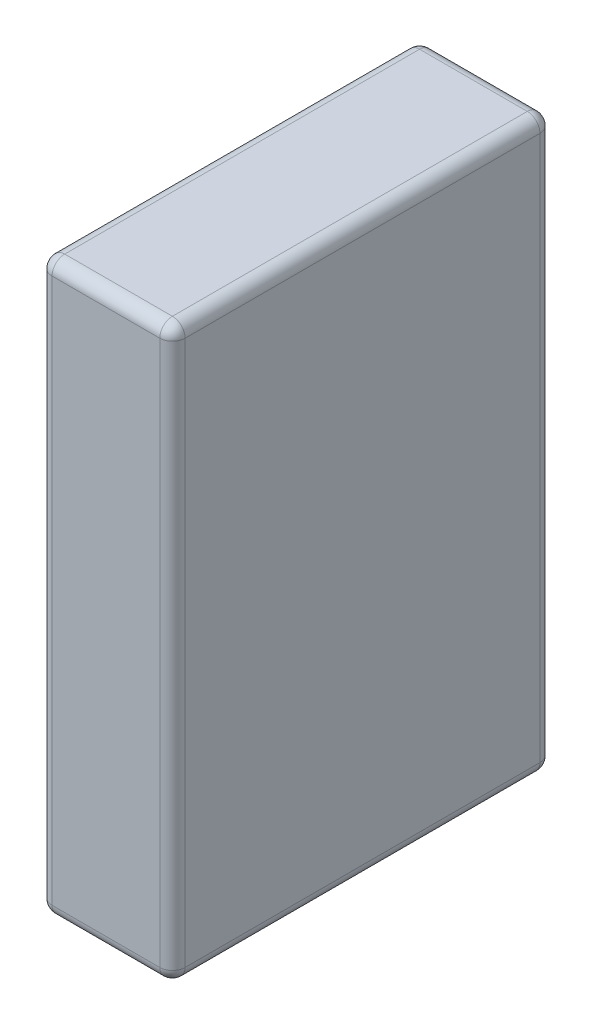
from build123d import *

# Parameters (mm, degrees)
SKETCH_1_W          = 60
SKETCH_1_H          = 90
EXTRUDE_1_DEPTH     = 21
SKETCH_2_R          = 2.5
CUT_EXTRUDE_1_DEPTH = 5
FILLET_2_R          = 2


with BuildPart() as part:
    # 草图1 → 凸台-拉伸1 (new body)
    with BuildSketch(Plane(origin=(0, 0, 0), x_dir=(0, 0, -1), z_dir=(1, 0, 0))):
        with Locations((-30, -45)):
            Rectangle(SKETCH_1_W, SKETCH_1_H)
    extrude(amount=EXTRUDE_1_DEPTH)

    # 草图2 → 切除-拉伸1 (cut)
    with BuildSketch(Plane(origin=(0, 0, 0), x_dir=(-1, 0, 0), z_dir=(0, 0, -1))):
        with Locations(Location((-10.5, -10, 0), (0, 0, 90))):
            Circle(SKETCH_2_R)
    extrude(amount=-CUT_EXTRUDE_1_DEPTH, mode=Mode.SUBTRACT)

    # 圆角2
    fillet_2_edges = [part.edges().sort_by_distance(p)[0] for p in [
        (21, -45, 60),
        (10.5, -12.5, 0),
        (21, -90, 30),
        (21, -45, 0),
        (0, -90, 30),
        (0, -45, 60),
        (0, 0, 30),
        (0, -45, 0),
        (10.5, -90, 0),
        (10.5, -90, 60),
        (10.5, 0, 60),
        (10.5, 0, 0),
        (21, 0, 30),
    ]]
    fillet(fillet_2_edges, radius=FILLET_2_R)


solid = part.part
